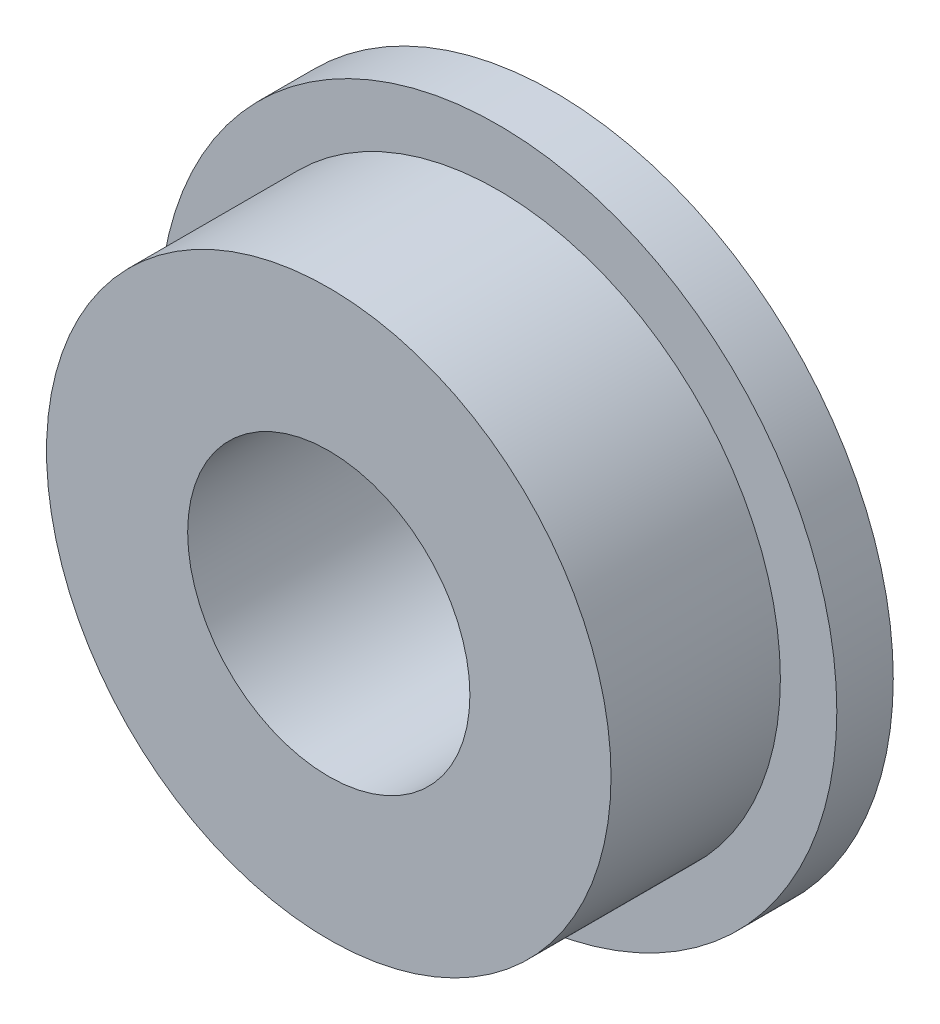
from build123d import *

# Parameters (mm, degrees)
SKETCH_1_R          = 6
EXTRUDE_1_DEPTH     = 1
SKETCH_2_R          = 5
EXTRUDE_2_DEPTH     = 3
SKETCH_3_R          = 2.5
CUT_EXTRUDE_1_DEPTH = 7


with BuildPart() as part:
    # 草图1 → 凸台-拉伸1 (new body)
    with BuildSketch(Plane.XY):
        Circle(SKETCH_1_R)
    extrude(amount=EXTRUDE_1_DEPTH)

    # 草图2 → 凸台-拉伸2 (add)
    with BuildSketch(Plane.XY.offset(1)):
        Circle(SKETCH_2_R)
    extrude(amount=EXTRUDE_2_DEPTH)

    # 草图3 → 切除-拉伸1 (cut)
    with BuildSketch(Plane.XY.offset(4)):
        Circle(SKETCH_3_R)
    extrude(amount=-CUT_EXTRUDE_1_DEPTH, mode=Mode.SUBTRACT)


solid = part.part
